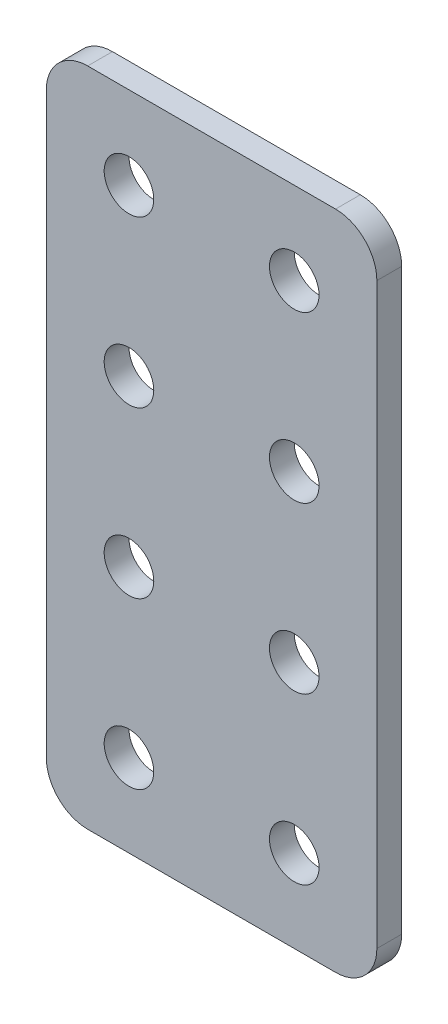
from build123d import *

# Parameters (mm, degrees)
SZKIC1_W                    = 40
SZKIC1_H                    = 40
SZKIC1_R                    = 3
DODANIE_WYCI_GNI_CIE1_DEPTH = 3
ZAOKR_GLENIE1_R             = 5


with BuildPart() as part:
    # Szkic1 → Dodanie-wyciągnięcie1 (new body)
    with BuildSketch(Plane.XY):
        with Locations((-6.490790255, 17.411764706)):
            Rectangle(SZKIC1_W, SZKIC1_H)
        with Locations((-16.490790255, 27.411764706)):
            Circle(SZKIC1_R, mode=Mode.SUBTRACT)
        with Locations((3.509209745, 27.411764706)):
            Circle(SZKIC1_R, mode=Mode.SUBTRACT)
        with Locations((-16.490790255, 7.411764706)):
            Circle(SZKIC1_R, mode=Mode.SUBTRACT)
        with Locations((3.509209745, 7.411764706)):
            Circle(SZKIC1_R, mode=Mode.SUBTRACT)
    dodanie_wyci_gni_cie1 = extrude(amount=DODANIE_WYCI_GNI_CIE1_DEPTH)

    # Lustro2: Dodanie-wyciągnięcie1 across plane
    add(dodanie_wyci_gni_cie1.mirror(Plane(origin=(-26.490790255, -2.588235294, 3), x_dir=(0, 0, 1), z_dir=(0, 1, 0))))

    # Zaokrąglenie1
    zaokr_glenie1_edges = [part.edges().sort_by_distance(p)[0] for p in [
        (-26.490790255, -42.588235294, 1.5),
        (13.509209745, -42.588235294, 1.5),
        (-26.490790255, 37.411764706, 1.5),
        (13.509209745, 37.411764706, 1.5),
    ]]
    fillet(zaokr_glenie1_edges, radius=ZAOKR_GLENIE1_R)


solid = part.part
